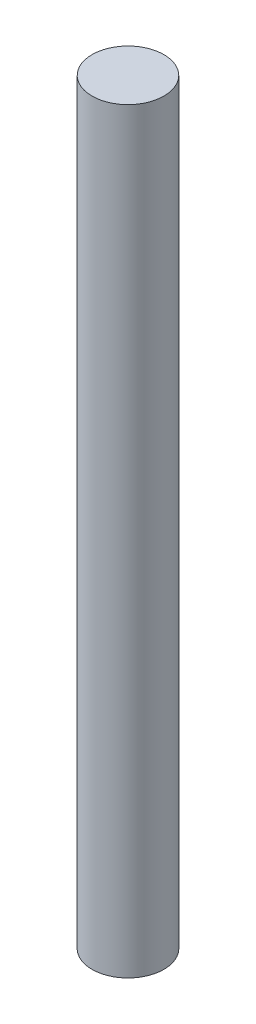
from build123d import *

# Parameters (mm, degrees)
SKETCH1_R           = 4.75
BOSS_EXTRUDE1_DEPTH = 100


with BuildPart() as part:
    # Sketch1 → Boss-Extrude1 (new body)
    with BuildSketch(Plane(origin=(0, 0, 0), x_dir=(1, 0, 0), z_dir=(0, 1, 0))):
        with Locations(Location((0, 0, 0), (0, 0, 270))):
            Circle(SKETCH1_R)
    extrude(amount=BOSS_EXTRUDE1_DEPTH)


solid = part.part
